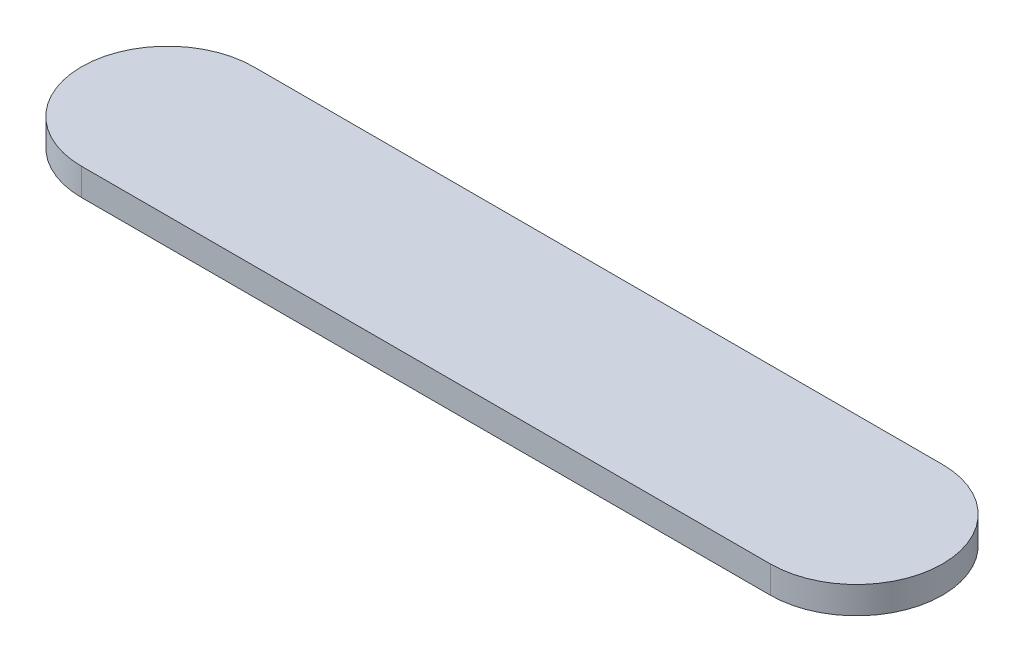
from build123d import *

# Parameters (mm, degrees)
BOSS_EXTRUDE1_DEPTH = 4


with BuildPart() as part:
    # Sketch1 → Boss-Extrude1 (new body)
    with BuildSketch(Plane(origin=(0, 0, 0), x_dir=(1, 0, 0), z_dir=(0, 1, 0))):
        with BuildLine():
            Line((-50.8, 12.7), (50.8, 12.7))
            ThreePointArc((50.8, 12.7), (63.5, 0), (50.8, -12.7))
            Line((50.8, -12.7), (-50.8, -12.7))
            ThreePointArc((-50.8, -12.7), (-63.5, 0), (-50.8, 12.7))
        make_face()
    extrude(amount=BOSS_EXTRUDE1_DEPTH)


solid = part.part
